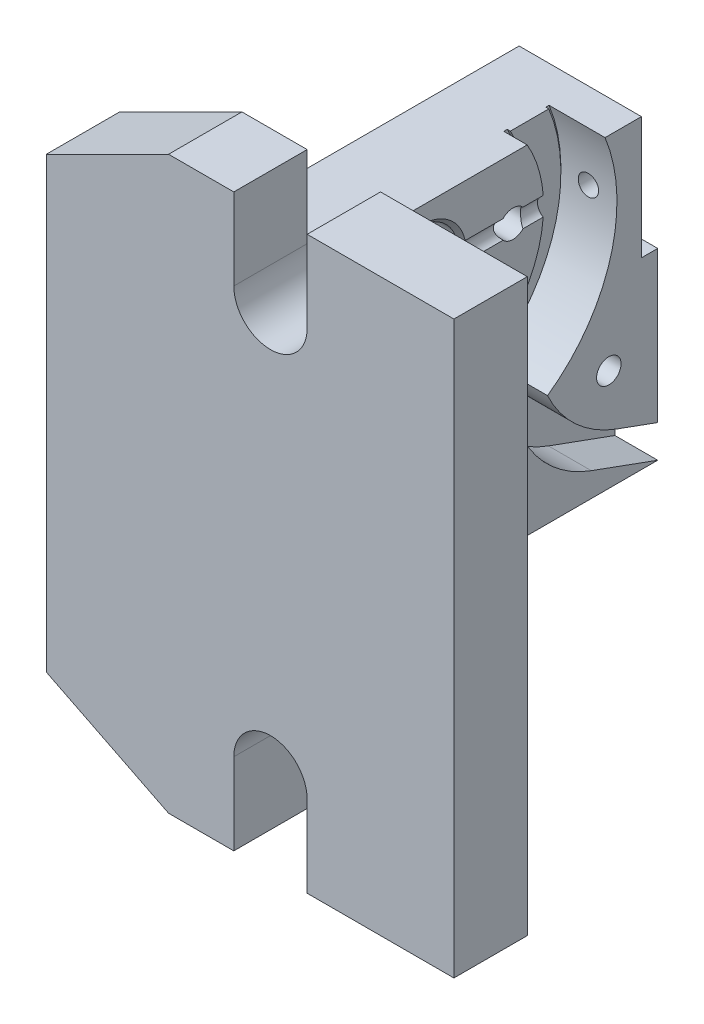
from build123d import *

# Parameters (mm, degrees)
EXTRUDE_1_DEPTH                  = 10.5
SKETCH_2_W                       = 102.00000000000001
SKETCH_2_H                       = 75.00000000000009
EXTRUDE_2_DEPTH                  = 19.4993693487819
EXTRUDE_3_DEPTH                  = 18.000000000000004
SKETCH_4_W                       = 18.000000000000004
SKETCH_4_H                       = 140
EXTRUDE_4_DEPTH                  = 70.0006306512181
EXTRUDE_START                    = 10.499999999999998
EXTRUDE_5_DEPTH                  = 10.499999999999998
CUT_EXTRUDE_1_REACH              = 194.401
SKETCH_7_W                       = 4.000000000000014
SKETCH_7_H                       = 29.999999999999993
CUT_EXTRUDE_2_DEPTH              = 201.0099997500125
CUT_EXTRUDE_3_DEPTH              = 210.76176963403032
CUT_EXTRUDE_4_DEPTH              = 210.76176963403032
EXTRUDE_6_DEPTH                  = 0.7500000000000007
HOLE_WIZARD_M521_D               = 61.5
EXTRUDE_7_DEPTH                  = 5.749999999999998
HOLE_WIZARD_6_7_6_7_1_AT_2_COUNT = 2
HOLE_WIZARD_6_7_6_7_1_AT_2_PITCH = 45
HOLE_WIZARD_4_0_4_1_AT_2_COUNT   = 2
HOLE_WIZARD_4_0_4_1_AT_2_PITCH   = 49.49747468305833
CHAMFER_1_SIZE                   = 0.9999999999999991
EXTRUDE_START_2                  = -16.249369
SKETCH_28_R                      = 3.35
SKETCH_28_R_2                    = 9.999999999999993
SKETCH_28_R_3                    = 3.350000000000003
EXTRUDE_8_DEPTH                  = 16.249369


with BuildPart() as part:
    # Эскиз1 → Бобышка-Вытянуть1 (new body)
    with BuildSketch(Plane(origin=(29.9993693487819, 0, 0), x_dir=(0, 0, -1), z_dir=(1, 0, 0))):
        with BuildLine():
            Line((14.919229074297327, 90.0005475751909), (0, 90.0005475751909))
            Line((0, 90.0005475751909), (0, 15.0005475751908))
            Line((0, 15.0005475751908), (102.00000000000001, 15.0005475751908))
            Line((102.00000000000001, 15.0005475751908), (85.69382268537409, 20.93551075238141))
            ThreePointArc((85.69382268537409, 20.93551075238141), (74.94644857866616, 27.70982740688085), (67.9664449575318, 38.324768093192546))
            ThreePointArc((67.9664449575318, 38.324768093192546), (24.088528585175357, 46.3477790832992), (14.919229074297327, 90.0005475751909))
        make_face()
    extrude(amount=-EXTRUDE_1_DEPTH)

    # Эскиз2 → Бобышка-Вытянуть2 (add)
    with BuildSketch(Plane.ZY.offset(-19.4993693487819)):
        with Locations((-51.00000000000001, 52.50054757519085)):
            Rectangle(SKETCH_2_W, SKETCH_2_H)
    extrude(amount=EXTRUDE_2_DEPTH)

    # Эскиз3 → Бобышка-Вытянуть3 (add)
    with BuildSketch(Plane.XY):
        Polygon((29.999369348781915, -6.94e-15), (3.47e-15, 15.000547575190799), (0, 124.997494914823), (29.997641385548, 140), (29.999369348781904, 140), align=None)
    extrude(amount=EXTRUDE_3_DEPTH)

    # Эскиз4 → Бобышка-Вытянуть4 (add)
    with BuildSketch(Plane(origin=(29.9993693487819, 0, 0), x_dir=(0, 0, -1), z_dir=(1, 0, 0))):
        with Locations((-9.000000000000002, 70)):
            Rectangle(SKETCH_4_W, SKETCH_4_H)
    extrude(amount=EXTRUDE_4_DEPTH)

    # Эскиз5 → Бобышка-Вытянуть5 (add)
    with BuildSketch(Plane(origin=(19.4993693487819, 0, 0), x_dir=(0, 0, -1), z_dir=(1, 0, 0)).offset(EXTRUDE_START)):
        with BuildLine():
            Line((89.08077092570272, 90.0005475751909), (102.00000000000001, 90.0005475751909))
            Line((102.00000000000001, 90.0005475751909), (102.00000000000001, 23.000547575190808))
            Line((102.00000000000001, 23.000547575190808), (91.92678266011816, 26.666898850201964))
            ThreePointArc((91.92678266011816, 26.666898850201964), (81.8910585435448, 32.765618882150974), (74.9654117449494, 42.24958224106233))
            ThreePointArc((74.9654117449494, 42.24958224106233), (90.35915387380979, 63.660894475956894), (89.08077092570272, 90.0005475751909))
        make_face()
    extrude(amount=-EXTRUDE_5_DEPTH)

    # Эскиз6 → Вырез-Вытянуть1 (cut, up to next)
    with BuildSketch(Plane(origin=(16.2493693487819, 0, 0), x_dir=(0, -1, 0), z_dir=(-1, 0, 0)), mode=Mode.PRIVATE) as cut_extrude_1_sk1:
        with BuildLine():
            Line((-90.0005475751909, -14.919229074297327), (-90.0005475751909, -89.08077092570272))
            ThreePointArc((-90.0005475751909, -89.08077092570272), (-34.999999999999936, -52), (-90.0005475751909, -14.919229074297327))
        make_face()
    cut_extrude_1_tool1 = extrude(cut_extrude_1_sk1.sketch, amount=-CUT_EXTRUDE_1_REACH, mode=Mode.PRIVATE) & part.part
    add(cut_extrude_1_tool1.solids().sort_by_distance((16.249369, 65.774947, -52))[0], mode=Mode.SUBTRACT)

    # Эскиз7 → Вырез-Вытянуть2 (cut, through all)
    with BuildSketch(Plane.ZY):
        with Locations((-100, 75.0005475751909)):
            Rectangle(SKETCH_7_W, SKETCH_7_H)
    extrude(amount=-CUT_EXTRUDE_2_DEPTH, mode=Mode.SUBTRACT)

    # Эскиз8 → Вырез-Вытянуть3 (cut, through all)
    with BuildSketch(Plane.XY.offset(18.000000000000004)):
        with BuildLine():
            Line((64, 140), (45.999999999999986, 140))
            Line((45.999999999999986, 140), (46, 120))
            ThreePointArc((46, 120), (55, 111), (64, 120))
            Line((64, 120), (64, 140))
        make_face()
    extrude(amount=-CUT_EXTRUDE_3_DEPTH, mode=Mode.SUBTRACT)

    # Эскиз9 → Вырез-Вытянуть4 (cut, through all)
    with BuildSketch(Plane.XY.offset(18.000000000000004)):
        with BuildLine():
            Line((46.00000000000001, 0), (64, 0))
            Line((64, 0), (64, 20.000000000000004))
            ThreePointArc((64, 20.000000000000004), (55, 29), (45.999999999999986, 20.000000000000004))
            Line((45.999999999999986, 20.000000000000004), (46.00000000000001, 0))
        make_face()
    extrude(amount=-CUT_EXTRUDE_4_DEPTH, mode=Mode.SUBTRACT)

    # Эскиз10 → Бобышка-Вытянуть6 (add)
    with BuildSketch(Plane(origin=(16.2493693487819, 0, 0), x_dir=(0, 0, -1), z_dir=(1, 0, 0))):
        with BuildLine():
            Line((15.729542704227807, 90.0005475751909), (88.27045729577222, 90.00054757519085))
            ThreePointArc((88.27045729577222, 90.00054757519085), (51.999999999999986, 35.75000000000001), (15.729542704227807, 90.0005475751909))
        make_face()
    extrude(amount=EXTRUDE_6_DEPTH)

    # Отверстие с зазором M521 (through all)
    with Locations(Plane(origin=(16.999369348781904, 0, 0), x_dir=(0, 0, -1), z_dir=(1, 0, 0))):
        with Locations((52, 75)):
            Hole(HOLE_WIZARD_M521_D / 2)

    # Эскиз14 → Отверстие1 (revolve, cut)
    with BuildSketch(Plane(origin=(29.9993693487819, 27.0005475751908, -62), x_dir=(0, 0, -1), z_dir=(0, 1, 0))):
        Polygon((0, 0), (0, 29.9993693487819), (3.1869530848864884, 29.9993693487819), (3.186953084886492, -8.3e-16), align=None)
    revolve(axis=Axis((-80.0006306512181, 27.0005475751908, -62), (1, 0, 0)), mode=Mode.SUBTRACT)

    # Эскиз20 → Диаметр отверстия Ø4.0 (4)1 (revolve, cut)
    with BuildSketch(Plane(origin=(16.999369348781904, 75, -17), x_dir=(0, 0, -1), z_dir=(0, 1, 0))):
        Polygon((0, 0), (-4.16e-15, 16.999369348781904), (1.9999999999999978, 16.999369348781904), (1.9999999999999896, -1.31e-15), align=None)
    hole_wizard_4_0_4_1 = revolve(axis=Axis((23.349369348781895, 75, -17), (-1, 0, 0)), mode=Mode.SUBTRACT)

    # Диаметр отверстия Ø4.0 (4)1 at 2: Диаметр отверстия Ø4.0 (4)1 ×2
    with Locations(*[Vector(0, -0.7071067811865475, -0.7071067811865477) * (i * HOLE_WIZARD_4_0_4_1_AT_2_PITCH) for i in range(1, HOLE_WIZARD_4_0_4_1_AT_2_COUNT)]):
        add(hole_wizard_4_0_4_1, mode=Mode.SUBTRACT)

    # Эскиз22 → Диаметр отверстия Ø6.0 (6)1 (revolve, cut)
    with BuildSketch(Plane(origin=(29.9993693487819, 40.0005475751908, -90), x_dir=(0, 0, -1), z_dir=(0, 1, 0))):
        Polygon((0, 0), (-7.35e-15, 30.000369348781906), (2.9999999999999867, 30.000369348781906), (2.9999999999999907, -1.19e-15), align=None)
    revolve(axis=Axis((36.34936934878189, 40.0005475751908, -90), (-1, 0, 0)), mode=Mode.SUBTRACT)


with BuildPart() as body_2:
    # Эскиз13 → Бобышка-Вытянуть7 (new body)
    with BuildSketch(Plane(origin=(16.2493693487819, 0, 0), x_dir=(0, -1, 0), z_dir=(-1, 0, 0))):
        with BuildLine():
            Line((-90.0005475751909, -26.01955403684463), (-90.0005475751909, -77.98044596315543))
            ThreePointArc((-90.0005475751909, -77.98044596315543), (-44.99999999999993, -51.99999999999999), (-90.0005475751909, -26.01955403684463))
        make_face()
    extrude(amount=-EXTRUDE_7_DEPTH)

    # Эскиз16 → Диаметр отверстия Ø6.7 (6.7)1 (revolve, cut)
    with BuildSketch(Plane(origin=(21.9993693487819, 75, -74.5), x_dir=(0, 0, -1), z_dir=(0, 1, 0))):
        Polygon((0, 0), (-1.41e-15, 5.749999999999998), (3.3500000000000045, 5.749999999999998), (3.3499999999999934, -1.15e-15), align=None)
    hole_wizard_6_7_6_7_1 = revolve(axis=Axis((28.34936934878189, 75, -74.5), (-1, 0, 0)), mode=Mode.SUBTRACT)

    # Диаметр отверстия Ø6.7 (6.7)1 at 2: Диаметр отверстия Ø6.7 (6.7)1 ×2
    with Locations(*[(0, 0, i * HOLE_WIZARD_6_7_6_7_1_AT_2_PITCH) for i in range(1, HOLE_WIZARD_6_7_6_7_1_AT_2_COUNT)]):
        add(hole_wizard_6_7_6_7_1, mode=Mode.SUBTRACT)

    # Эскиз18 → Диаметр отверстия Ø20.0 (20)1 (revolve, cut)
    with BuildSketch(Plane(origin=(21.9993693487819, 75, -52.00000000000001), x_dir=(0, 0, -1), z_dir=(0, 1, 0))):
        Polygon((0, 0), (-1.41e-15, 5.7510000000000066), (9.99999999999999, 5.7510000000000066), (9.99999999999999, -3.3e-16), align=None)
    revolve(axis=Axis((28.34936934878189, 75, -52.00000000000001), (-1, 0, 0)), mode=Mode.SUBTRACT)


with BuildPart() as hole_wizard_5_0_5_1_tool:
    # Эскиз24 → Диаметр отверстия Ø5.0 (5)1 (revolve)
    with BuildSketch(Plane(origin=(23, 75.0005475751909, -98), x_dir=(0, 1, 0), z_dir=(1, 0, 0))):
        Polygon((0, 0), (-1.127e-14, 45.999999999999986), (2.499999999999981, 45.999999999999986), (2.4999999999999867, -1.25e-15), align=None)
    revolve(axis=Axis((23, 75.0005475751909, -104.35), (0, 0, 1)))


with BuildPart() as part_1:
    add(part.part)

    # Диаметр отверстия Ø5.0 (5)1: cut by hole_wizard_5_0_5_1_tool
    add(hole_wizard_5_0_5_1_tool.part, mode=Mode.SUBTRACT)

    # Эскиз26 → Отверстие с зазором M61 (revolve, cut)
    with BuildSketch(Plane(origin=(15.8866729980809, 33.128633292951, -102.00000000000001), x_dir=(0, 1, 0), z_dir=(1, 0, 0))):
        Polygon((0, 0), (-1.47e-15, 5.999999999999993), (3.2357711959407984, 6.000000000000005), (3.2357711959408, -1.16e-15), align=None)
    revolve(axis=Axis((15.8866729980809, 33.128633292951, -108.35000000000001), (0, 0, 1)), mode=Mode.SUBTRACT)


with BuildPart() as body_2_1:
    add(body_2.part)

    # Диаметр отверстия Ø5.0 (5)1: cut by hole_wizard_5_0_5_1_tool
    add(hole_wizard_5_0_5_1_tool.part, mode=Mode.SUBTRACT)

    # Фаска1
    chamfer_1_edges = [body_2_1.edges().sort_by_distance(p)[0] for p in [
        (21.9993693487819, 74.99943746278025, -42.00000001582242),
    ]]
    chamfer(chamfer_1_edges, length=CHAMFER_1_SIZE)


with BuildPart() as extrude_8_tool:
    # Эскиз28 → Бобышка-Вытянуть8 (new body)
    with BuildSketch(Plane.ZY.offset(EXTRUDE_START_2)):
        with BuildLine():
            Line((-78.84298926059529, 90.0005475751909), (-25.157010739404722, 90.0005475751909))
            ThreePointArc((-25.157010739404722, 90.0005475751909), (-52.000000000000014, 44.250000000000014), (-78.84298926059529, 90.0005475751909))
        make_face()
        with Locations(Location((-29.500000000000004, 75, 0), (0, 0, 180))):
            Circle(SKETCH_28_R, mode=Mode.SUBTRACT)
        with Locations(Location((-52.00000000000001, 75, 0), (0, 0, 188.618876561))):
            Circle(SKETCH_28_R_2, mode=Mode.SUBTRACT)
        with Locations(Location((-74.5, 75, 0), (0, 0, 223.135094042))):
            Circle(SKETCH_28_R_3, mode=Mode.SUBTRACT)
    extrude(amount=EXTRUDE_8_DEPTH)


with BuildPart() as part_2:
    add(part_1.part)


with BuildPart() as part_3:
    # Бобышка-Вытянуть8: joined with extrude_8_tool
    add(part_2.part.fuse(extrude_8_tool.part, body_2_1.part, tol=0.00001))


solid = part_3.part
